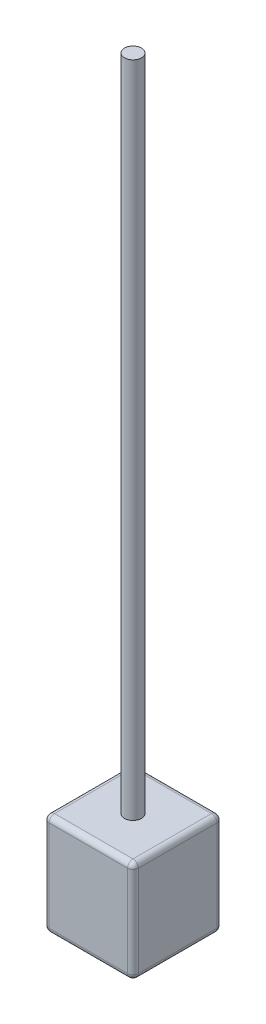
from build123d import *

# Parameters (mm, degrees)
SKETCH1_W           = 42
SKETCH1_H           = 42
BOSS_EXTRUDE1_DEPTH = 48
SKETCH2_R           = 4
BOSS_EXTRUDE2_DEPTH = 310
FILLET1_R           = 2.54


with BuildPart() as part:
    # Sketch1 → Boss-Extrude1 (new body)
    with BuildSketch(Plane(origin=(0, 0, 0), x_dir=(1, 0, 0), z_dir=(0, 1, 0))):
        Rectangle(SKETCH1_W, SKETCH1_H)
    extrude(amount=BOSS_EXTRUDE1_DEPTH)

    # Sketch2 → Boss-Extrude2 (add)
    with BuildSketch(Plane(origin=(0, 48, 0), x_dir=(1, 0, 0), z_dir=(0, 1, 0))):
        with Locations(Location((0, 0, 0), (0, 0, 90))):
            Circle(SKETCH2_R)
    extrude(amount=BOSS_EXTRUDE2_DEPTH)

    # Fillet1
    fillet1_edges = [part.edges().sort_by_distance(p)[0] for p in [
        (-21, 48, 0),
        (0, 48, 21),
        (21, 48, 0),
        (0, 0, 21),
        (-21, 0, 0),
        (0, 0, -21),
        (21, 0, 0),
        (0, 48, -21),
        (21, 24, 21),
        (-21, 24, 21),
        (-21, 24, -21),
        (21, 24, -21),
    ]]
    fillet(fillet1_edges, radius=FILLET1_R)


solid = part.part
